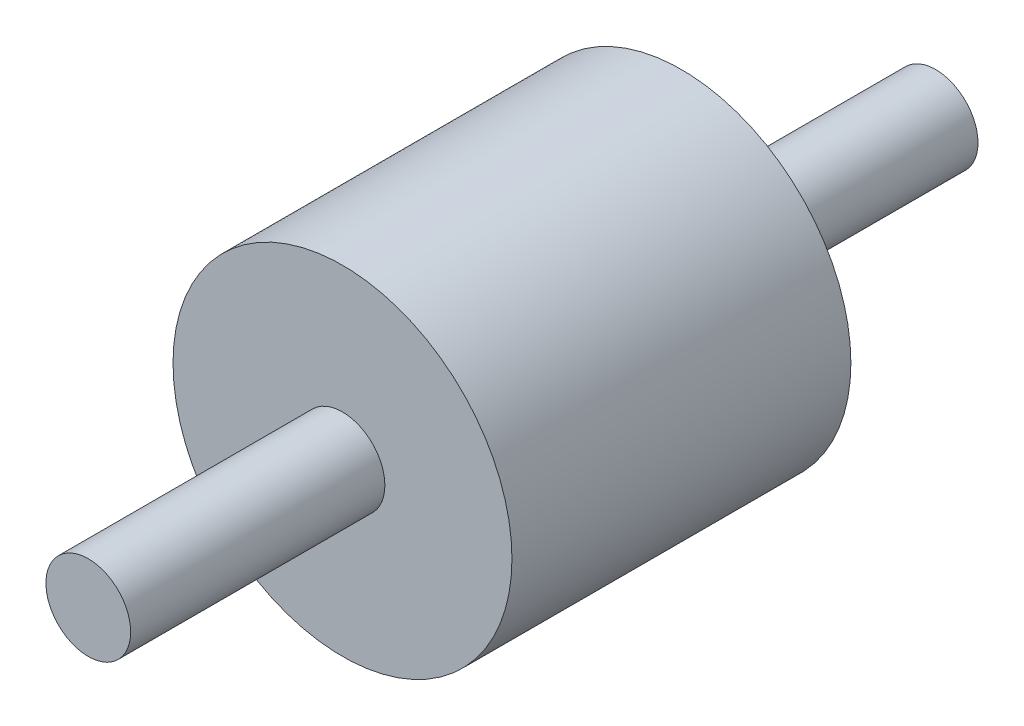
from build123d import *

# Parameters (mm, degrees)
BOSS_EXTRU_1_DEPTH      = 4
BOSS_EXTRU_1_DEPTH_BACK = 4
ESQUISSE1_R             = 4
BOSS_EXTRU_2_DEPTH      = 10
BOSS_EXTRU_2_DEPTH_BACK = 10
ESQUISSE2_R             = 1


with BuildPart() as part:
    # Esquisse1 → Boss.-Extru.1 (new, two sides: drawn at the far end of the back side and taken through both)
    with BuildSketch(Plane.XY.offset(-BOSS_EXTRU_1_DEPTH_BACK)):
        Circle(ESQUISSE1_R)
    extrude(amount=BOSS_EXTRU_1_DEPTH + BOSS_EXTRU_1_DEPTH_BACK)

    # Esquisse2 → Boss.-Extru.2 (add, two sides: drawn at the far end of the back side and taken through both)
    with BuildSketch(Plane.XY.offset(-BOSS_EXTRU_2_DEPTH_BACK)):
        Circle(ESQUISSE2_R)
    extrude(amount=BOSS_EXTRU_2_DEPTH + BOSS_EXTRU_2_DEPTH_BACK)


solid = part.part
